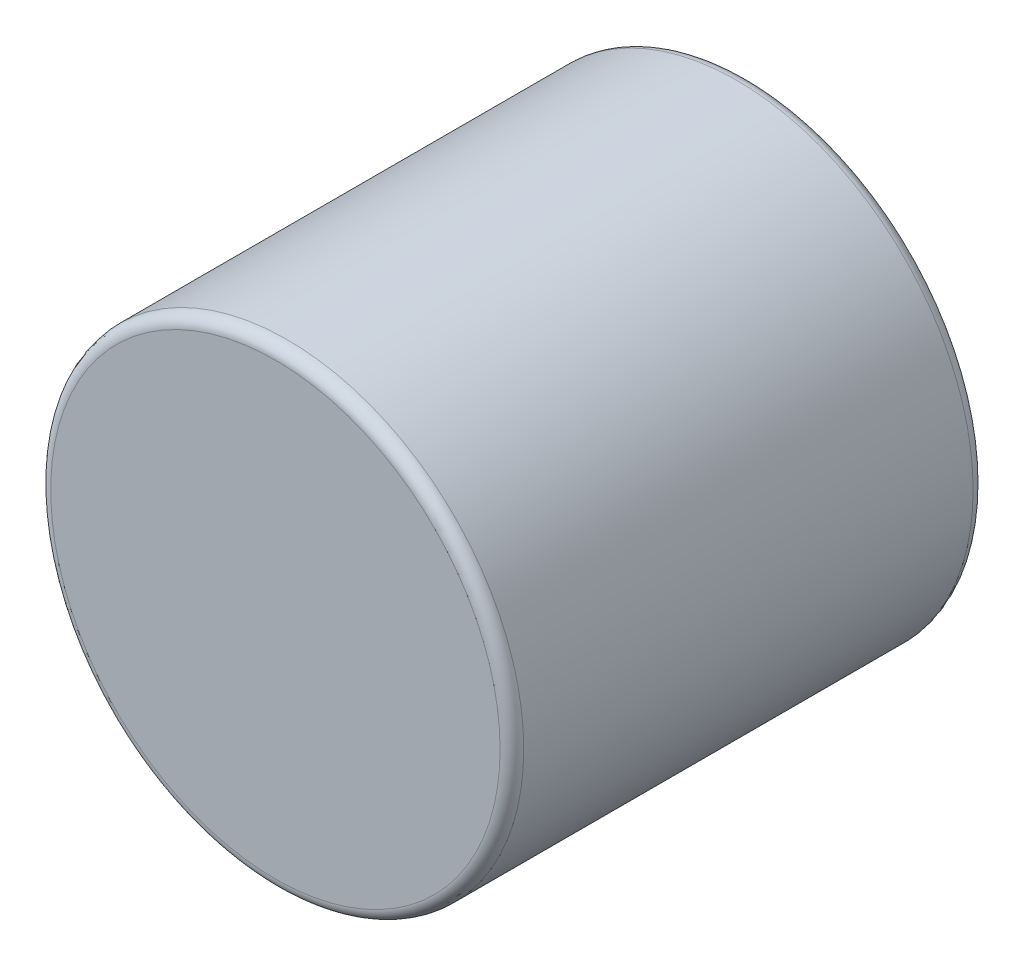
from build123d import *

# Parameters (mm, degrees)
BOSS_EXTRUDE1_DEPTH      = 1.5875
BOSS_EXTRUDE1_DEPTH_BACK = 1.5875
SKETCH3_R                = 1.5875
FILLET1_R                = 0.079375


with BuildPart() as part:
    # Sketch3 → Boss-Extrude1 (new, two sides: drawn at the far end of the back side and taken through both)
    with BuildSketch(Plane.XY.offset(-BOSS_EXTRUDE1_DEPTH_BACK)):
        Circle(SKETCH3_R)
    extrude(amount=BOSS_EXTRUDE1_DEPTH + BOSS_EXTRUDE1_DEPTH_BACK)

    # Fillet1
    fillet1_edges = [part.edges().sort_by_distance(p)[0] for p in [
        (-1.5875, 0, -1.5875),
        (-1.5875, 0, 1.5875),
    ]]
    fillet(fillet1_edges, radius=FILLET1_R)


solid = part.part
